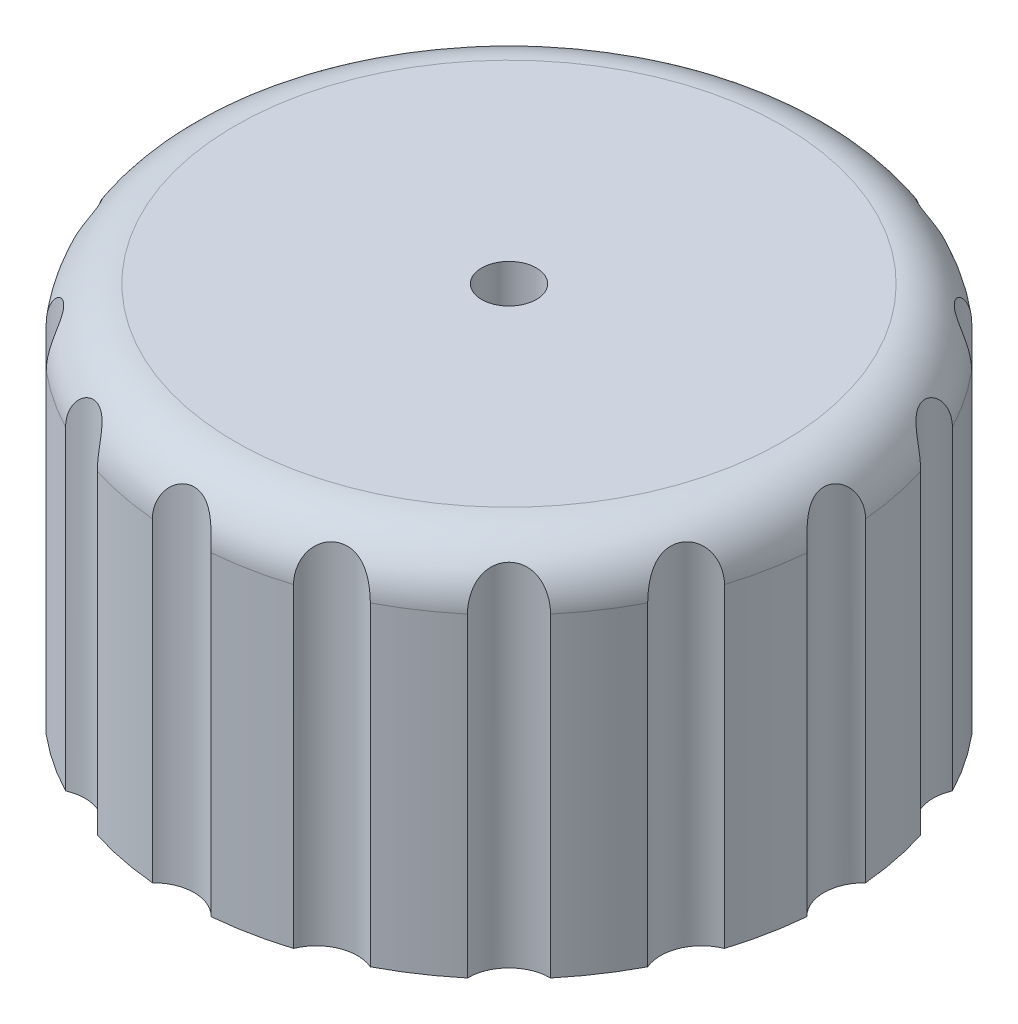
from build123d import *

# Parameters (mm, degrees)
FILLET1_R          = 1
SKETCH2_R          = 0.75
CUT_EXTRUDE1_DEPTH = 12.661903841
CIRPATTERN1_COUNT  = 16
SKETCH3_R          = 0.5
CUT_EXTRUDE2_DEPTH = 12.637191955


with BuildPart() as part:
    # Sketch1 → Revolve1 (revolve)
    with BuildSketch(Plane.XY, mode=Mode.PRIVATE) as revolve1_sk:
        Polygon((-2.765, 0), (-2.765, 2.891054023), (0, 2.891054023), (0, 8), (-6, 8), (-6, 1.24483654), (-4.003398957, 1.24483654), (-3.067620744, 0), align=None)
    revolve(revolve1_sk.sketch.rotate(Axis((0, 2.891054023, 0), (0, 1, 0)), 270), axis=Axis((0, 2.891054023, 0), (0, 1, 0)))

    # Fillet1
    fillet1_edges = [part.edges().sort_by_distance(p)[0] for p in [
        (0, 8, 6),
    ]]
    fillet(fillet1_edges, radius=FILLET1_R)

    # Sketch2 → Cut-Extrude1 (cut, through all)
    with BuildSketch(Plane(origin=(0, 0, 0), x_dir=(1, 0, 0), z_dir=(0, 1, 0))):
        with Locations((0, 6.5)):
            Circle(SKETCH2_R)
    cut_extrude1 = extrude(amount=CUT_EXTRUDE1_DEPTH, mode=Mode.SUBTRACT)

    # CirPattern1: Cut-Extrude1 ×16 about axis
    cirpattern1_axis = Axis((0, 0, 0), (0, 1, 0))
    for i in range(1, CIRPATTERN1_COUNT):
        add(cut_extrude1.rotate(cirpattern1_axis, i * 360 / CIRPATTERN1_COUNT), mode=Mode.SUBTRACT)

    # Sketch3 → Cut-Extrude2 (cut, through all)
    with BuildSketch(Plane(origin=(0, 0, 0), x_dir=(1, 0, 0), z_dir=(0, 1, 0))):
        with Locations(Location((0, 0, 0), (0, 0, 270))):
            Circle(SKETCH3_R)
    extrude(amount=CUT_EXTRUDE2_DEPTH, mode=Mode.SUBTRACT)


solid = part.part
